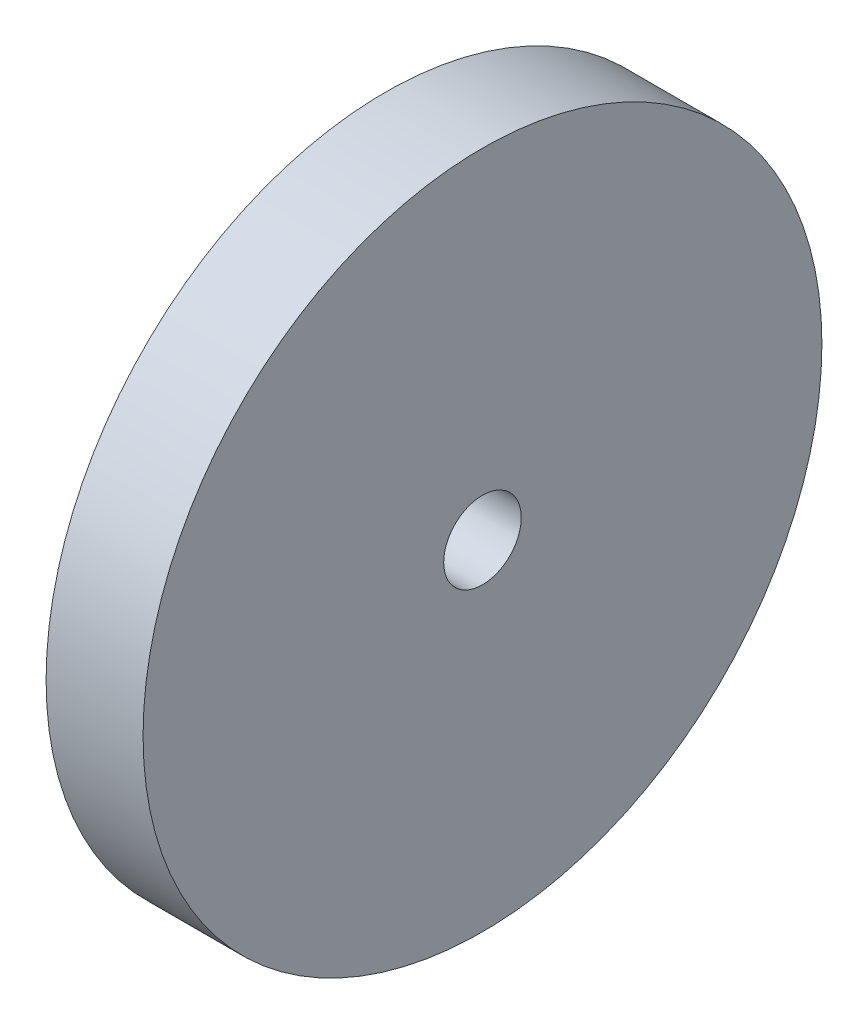
from build123d import *

# Parameters (mm, degrees)
SKETCH1_W = 10
SKETCH1_H = 31


with BuildPart() as part:
    # Sketch1 → Revolve1 (revolve)
    with BuildSketch(Plane.XY, mode=Mode.PRIVATE) as revolve1_sk:
        with Locations((5, 19.5)):
            Rectangle(SKETCH1_W, SKETCH1_H)
    revolve(revolve1_sk.sketch.rotate(Axis((0, 0, 0), (1, 0, 0)), 90), axis=Axis((0, 0, 0), (1, 0, 0)))


solid = part.part
